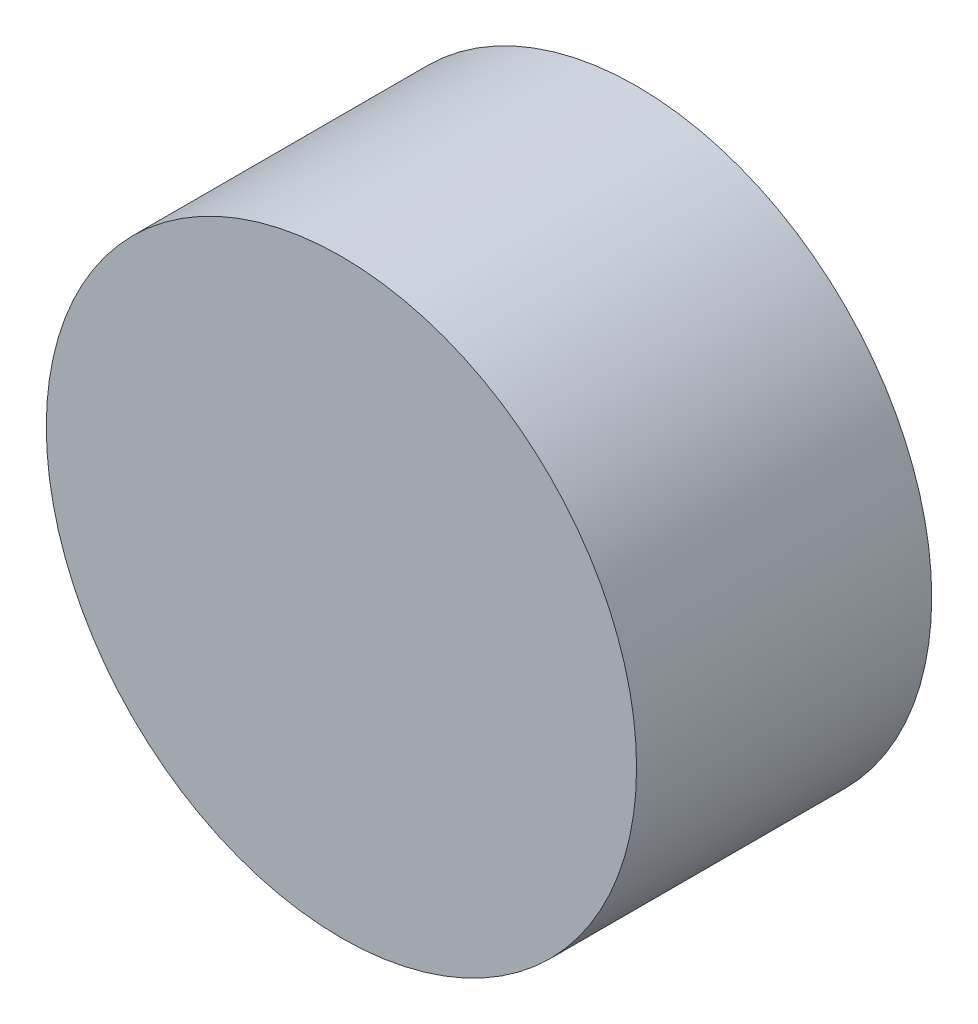
from build123d import *

# Parameters (mm, degrees)
SKETCH1_R           = 5
BOSS_EXTRUDE1_DEPTH = 5
SKETCH2_R           = 0.5
BOSS_EXTRUDE2_DEPTH = 1


with BuildPart() as part:
    # Sketch1 → Boss-Extrude1 (new body)
    with BuildSketch(Plane.XY):
        Circle(SKETCH1_R)
    extrude(amount=BOSS_EXTRUDE1_DEPTH)

    # Sketch2 → Boss-Extrude2 (add, symmetric)
    with BuildSketch(Plane(origin=(0, 0, 0), x_dir=(1, 0, 0), z_dir=(0, 1, 0))):
        with BuildLine():
            Line((-1.25, 0), (1.25, 0))
            Line((1.25, 0), (1.25, 1.5))
            ThreePointArc((1.25, 1.5), (0, 2.75), (-1.25, 1.5))
            Line((-1.25, 1.5), (-1.25, 0))
        make_face()
        with Locations(Location((0, 1.5, 0), (0, 0, 270))):
            Circle(SKETCH2_R, mode=Mode.SUBTRACT)
    extrude(amount=BOSS_EXTRUDE2_DEPTH, both=True)


solid = part.part
